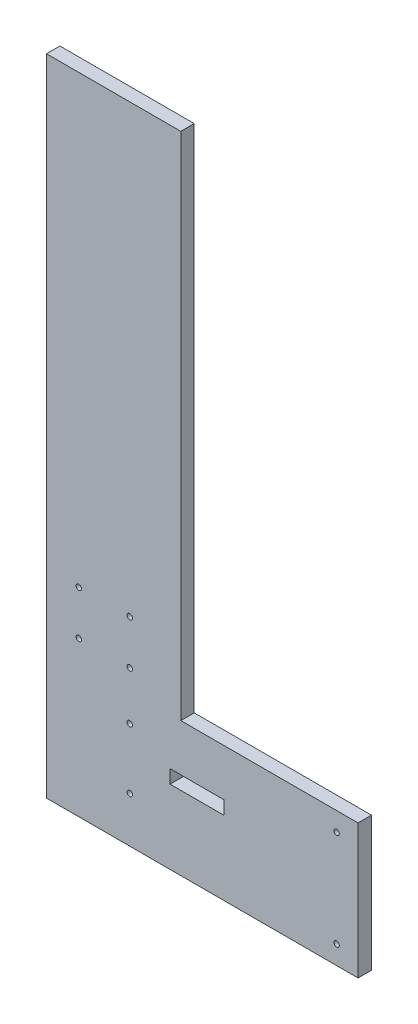
from build123d import *

# Parameters (mm, degrees)
SKETCH1_W           = 66
SKETCH1_H           = 50
SKETCH1_R           = 1
BOSS_EXTRUDE1_DEPTH = 5
SKETCH2_R           = 1
CUT_EXTRUDE1_DEPTH  = 388.996134001
SKETCH3_R           = 1
SKETCH3_W           = 20
SKETCH3_H           = 5
CUT_EXTRUDE2_DEPTH  = 388.996134001
CUT_EXTRUDE3_DEPTH  = 388.996134001


with BuildPart() as part:
    # Sketch1 → Boss-Extrude1 (new body)
    # profile 1 of 3: a face of its own
    with BuildSketch(Plane.XY):
        with Locations((-33, 85)):
            Rectangle(SKETCH1_W, SKETCH1_H)
    # profile 2 of 3: a face of its own
    with BuildSketch(Plane.XY):
        Polygon((0, 60), (0, 0), (180, 0), (180, 60), (180, 110), (180, 300), (130, 300), (130, 150), (50, 150), (50, 300), (0, 300), (0, 110), align=None)
        with Locations((19, 117.5)):
            Circle(SKETCH1_R, mode=Mode.SUBTRACT)
        with Locations((38, 117.5)):
            Circle(SKETCH1_R, mode=Mode.SUBTRACT)
        with Locations((19, 134)):
            Circle(SKETCH1_R, mode=Mode.SUBTRACT)
        with Locations((38, 134)):
            Circle(SKETCH1_R, mode=Mode.SUBTRACT)
        with Locations((142, 117.5)):
            Circle(SKETCH1_R, mode=Mode.SUBTRACT)
        with Locations((161, 117.5)):
            Circle(SKETCH1_R, mode=Mode.SUBTRACT)
        with Locations((142, 134)):
            Circle(SKETCH1_R, mode=Mode.SUBTRACT)
        with Locations((161, 134)):
            Circle(SKETCH1_R, mode=Mode.SUBTRACT)
    # profile 3 of 3: a face of its own
    with BuildSketch(Plane.XY):
        with Locations((213, 85)):
            Rectangle(SKETCH1_W, SKETCH1_H)
    extrude(amount=BOSS_EXTRUDE1_DEPTH)

    # Sketch2 → Cut-Extrude1 (cut, through all)
    with BuildSketch(Plane.XY.offset(5)):
        with Locations((-58, 103)):
            Circle(SKETCH2_R)
        with Locations((-58, 67)):
            Circle(SKETCH2_R)
        with Locations(Location((238, 67, 0), (0, 0, 180))):
            Circle(SKETCH2_R)
        with Locations(Location((238, 103, 0), (0, 0, 180))):
            Circle(SKETCH2_R)
    extrude(amount=-CUT_EXTRUDE1_DEPTH, mode=Mode.SUBTRACT)

    # Sketch3 → Cut-Extrude2 (cut, through all)
    with BuildSketch(Plane.XY.offset(5)):
        with Locations((19, 77)):
            Circle(SKETCH3_R)
        with Locations((19, 99.5)):
            Circle(SKETCH3_R)
        with Locations(Location((161, 77, 0), (0, 0, 180))):
            Circle(SKETCH3_R)
        with Locations(Location((161, 99.5, 0), (0, 0, 180))):
            Circle(SKETCH3_R)
        with Locations((-6, 90)):
            Rectangle(SKETCH3_W, SKETCH3_H)
        with Locations((186, 90)):
            Rectangle(SKETCH3_W, SKETCH3_H)
    extrude(amount=-CUT_EXTRUDE2_DEPTH, mode=Mode.SUBTRACT)

    # Sketch4 → Cut-Extrude3 (cut, through all)
    with BuildSketch(Plane.XY.offset(5)):
        Polygon((180, 60), (130, 60), (130, 150), (65.062754068, 311.897276324), (-51.051297303, 321.248743549), (-107.939389585, -9.16976505), (175.332138424, -20.859099081), (198.321162017, 8.753880463), align=None)
    extrude(amount=-CUT_EXTRUDE3_DEPTH, mode=Mode.SUBTRACT)


solid = part.part
